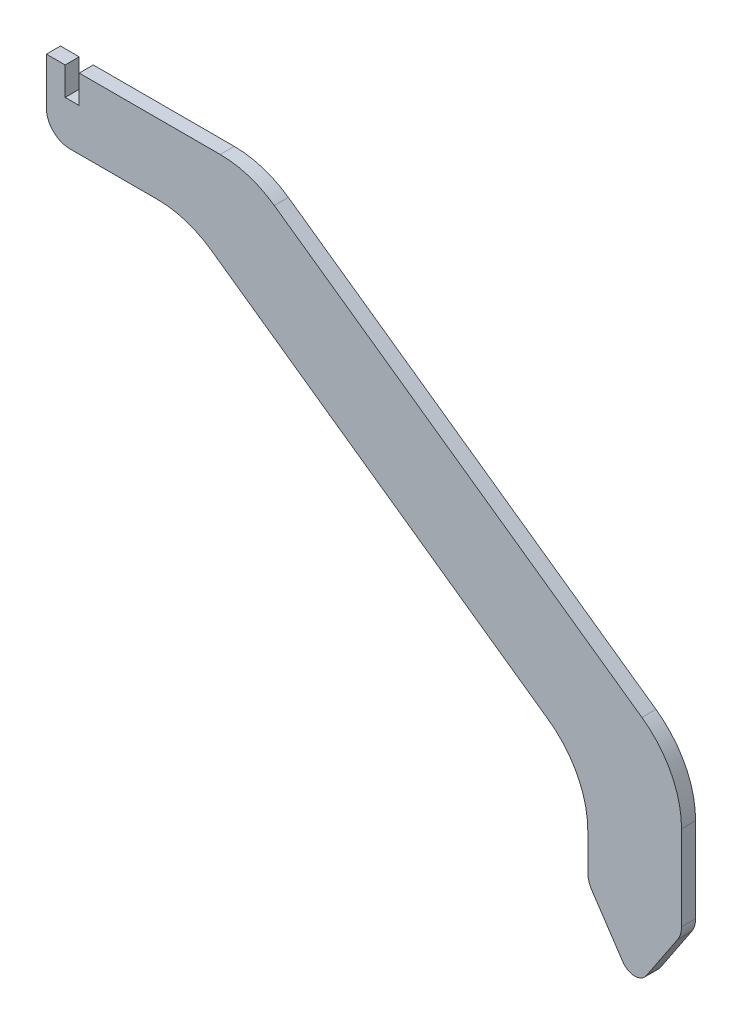
from build123d import *

# Parameters (mm, degrees)
BOSS_EXTRUDE1_DEPTH = 0.15
FILLET1_R           = 0.3
FILLET2_R           = 0.5
FILLET3_R           = 2


with BuildPart() as part:
    # Sketch1 → Boss-Extrude1 (new, symmetric)
    with BuildSketch(Plane.XY):
        Polygon((0, 0), (0.4, 0), (0.4, -0.6), (0.7, -0.6), (0.7, 0), (4.34307957, 0), (13.55, -6.5), (13.55, -9.5), (12.55, -11), (11.55, -9.5), (11.55, -7.5362203), (3, -1.5), (0, -1.5), align=None)
    extrude(amount=BOSS_EXTRUDE1_DEPTH, both=True)

    # Fillet1
    fillet1_edges = [part.edges().sort_by_distance(p)[0] for p in [
        (12.55, -11, 0),
    ]]
    fillet(fillet1_edges, radius=FILLET1_R)

    # Fillet2
    fillet2_edges = [part.edges().sort_by_distance(p)[0] for p in [
        (13.55, -9.5, 0),
        (11.55, -9.5, 0),
        (0, -1.5, 0),
    ]]
    fillet(fillet2_edges, radius=FILLET2_R)

    # Fillet3
    fillet3_edges = [part.edges().sort_by_distance(p)[0] for p in [
        (4.34307957, 0, 0),
        (13.55, -6.5, 0),
        (11.55, -7.5362203, 0),
        (3, -1.5, 0),
    ]]
    fillet(fillet3_edges, radius=FILLET3_R)


solid = part.part
